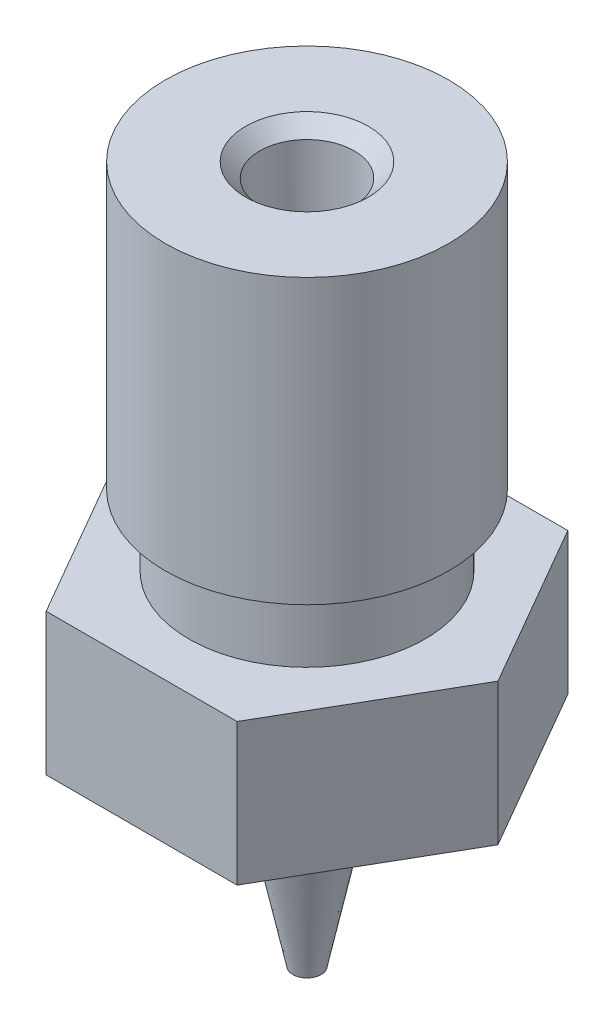
from build123d import *

# Parameters (mm, degrees)
BOSS_EXTRUDE1_START = -3
BOSS_EXTRUDE1_DEPTH = 3


with BuildPart() as part:
    # Sketch1 → Revolve1 (revolve)
    with BuildSketch(Plane.XY, mode=Mode.PRIVATE) as revolve1_sk:
        Polygon((0, 0), (0.5, 0), (1.900415076, 2), (3.5, 2), (3.5, 5), (2.5, 5), (2.5, 6.5), (3, 6.5), (3, 12.5), (0, 12.5), align=None)
    revolve(revolve1_sk.sketch.rotate(Axis((0, -1.1291331, 0), (0, -1, 0)), 180), axis=Axis((0, -1.1291331, 0), (0, -1, 0)))

    # Sketch2 → Cut-Revolve1 (revolve, cut)
    with BuildSketch(Plane.XY, mode=Mode.PRIVATE) as cut_revolve1_sk:
        Polygon((0, 12.5), (1.3, 12.5), (1, 12.2), (1, 1.985640646), (0.2, 0.6), (0.2, 0), (0, 0), align=None)
    revolve(cut_revolve1_sk.sketch.rotate(Axis((0, 0, 0), (0, 1, 0)), 90), axis=Axis((0, 0, 0), (0, 1, 0)), mode=Mode.SUBTRACT)

    # Sketch3 → Boss-Extrude1 (add)
    with BuildSketch(Plane.XZ.offset(-2).offset(BOSS_EXTRUDE1_START)):
        with BuildLine():
            ThreePointArc((-3.031088921, -1.749999986), (-3.5, 0), (-3.031088921, 1.749999986))
            Line((-3.031088921, 1.749999986), (-4.041451884, 0))
            Line((-4.041451884, 0), (-3.031088921, -1.749999986))
        make_face()
        with BuildLine():
            ThreePointArc((-3.031088921, 1.749999986), (-1.750000007, 3.031088909), (0, 3.5))
            Line((0, 3.5), (-2.020725942, 3.5))
            Line((-2.020725942, 3.5), (-3.031088921, 1.749999986))
        make_face()
        with BuildLine():
            ThreePointArc((0, 3.5), (1.750000007, 3.031088909), (3.031088922, 1.749999985))
            Line((3.031088922, 1.749999985), (2.020725942, 3.5))
            Line((2.020725942, 3.5), (0, 3.5))
        make_face()
        with BuildLine():
            Line((2.020725942, -3.5), (3.031088915, -1.749999996))
            ThreePointArc((3.031088915, -1.749999996), (1.750000009, -3.031088908), (1.6e-08, -3.5))
            Line((1.6e-08, -3.5), (2.020725942, -3.5))
        make_face()
        with BuildLine():
            Line((-2.020725942, -3.5), (1.6e-08, -3.5))
            ThreePointArc((1.6e-08, -3.5), (-1.75, -3.031088913), (-3.031088921, -1.749999986))
            Line((-3.031088921, -1.749999986), (-2.020725942, -3.5))
        make_face()
        with BuildLine():
            Line((3.031088915, -1.749999996), (4.041451884, 0))
            Line((4.041451884, 0), (3.031088922, 1.749999985))
            ThreePointArc((3.031088922, 1.749999985), (3.380740394, 0.90586665), (3.5, 0))
            ThreePointArc((3.5, 0), (3.380740393, -0.905866656), (3.031088915, -1.749999996))
        make_face()
    extrude(amount=BOSS_EXTRUDE1_DEPTH)

    # Sketch4 → Revolve2 (revolve)
    with BuildSketch(Plane.XY, mode=Mode.PRIVATE) as revolve2_sk:
        Polygon((0, 0), (0, -2.25), (0.3, -2.25), (0.885114146, 0.55), (1.3, 0.55), (1.3, 2), (1.008290377, 2), (1, 1.985640646), (0.2, 0.6), (0.2, 0), align=None)
    revolve(revolve2_sk.sketch.rotate(Axis((0, 2, 0), (0, -1, 0)), 180), axis=Axis((0, 2, 0), (0, -1, 0)))


solid = part.part
